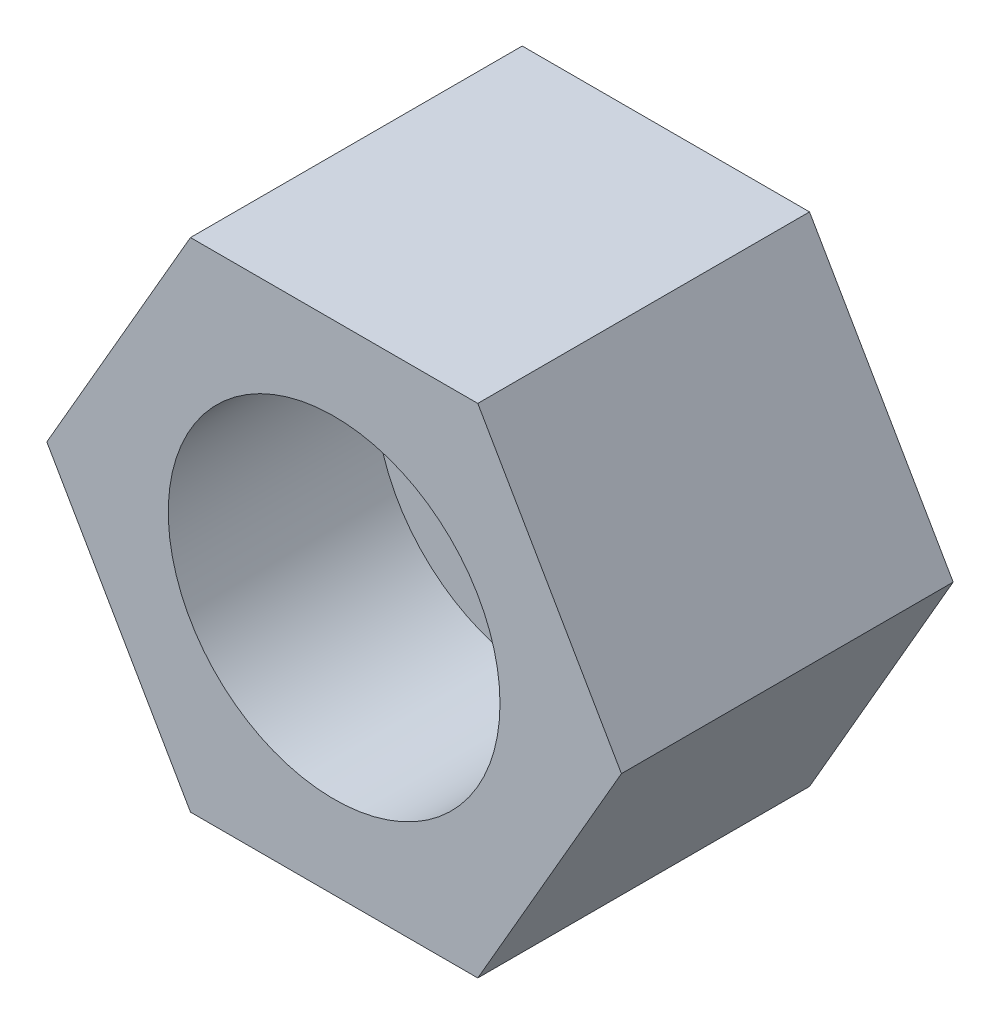
from build123d import *

# Parameters (mm, degrees)
SKETCH1_R           = 2.5
BOSS_EXTRUDE1_DEPTH = 4
SKETCH2_R           = 4
CUT_EXTRUDE1_DEPTH  = 5


with BuildPart() as part:
    # Sketch1 → Boss-Extrude1 (new, symmetric)
    with BuildSketch(Plane.XY):
        Polygon((6.92820323, 0), (3.464101615, 6), (-3.464101615, 6), (-6.92820323, 0), (-3.464101615, -6), (3.464101615, -6), align=None)
        Circle(SKETCH1_R, mode=Mode.SUBTRACT)
    extrude(amount=BOSS_EXTRUDE1_DEPTH, both=True)

    # Sketch2 → Cut-Extrude1 (cut)
    with BuildSketch(Plane.XY.offset(4)):
        Circle(SKETCH2_R)
    extrude(amount=-CUT_EXTRUDE1_DEPTH, mode=Mode.SUBTRACT)


solid = part.part
